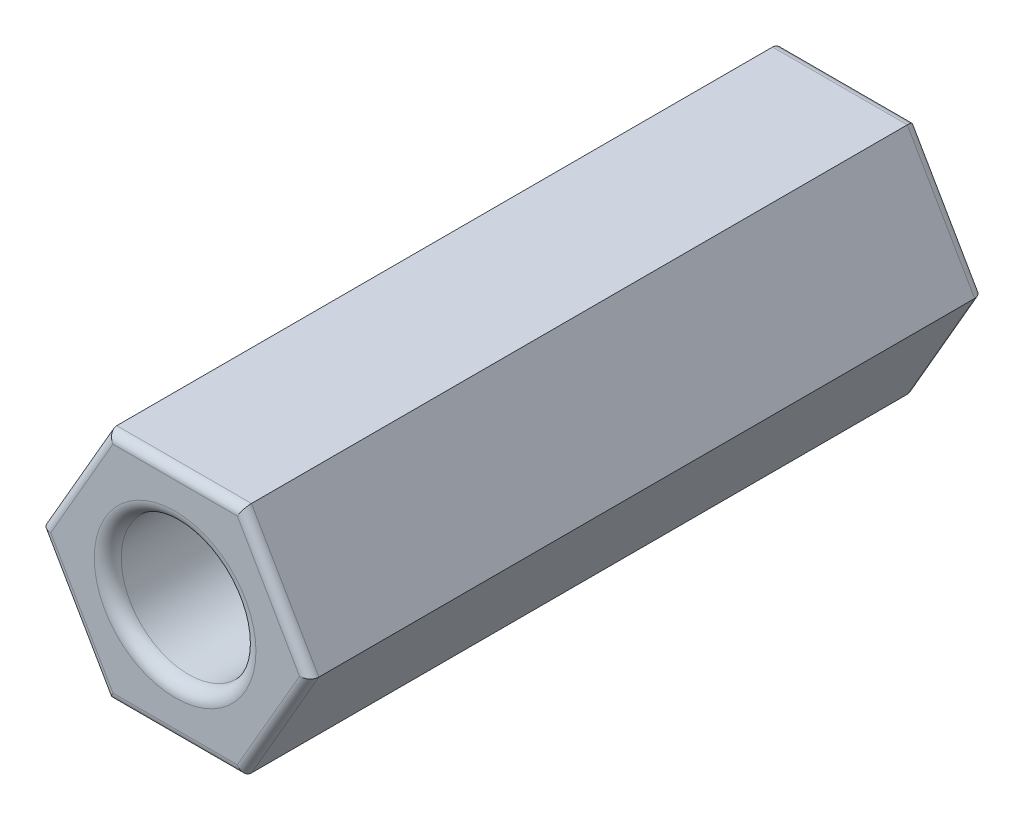
from build123d import *

# Parameters (mm, degrees)
SKETCH1_R           = 1.5
BOSS_EXTRUDE1_DEPTH = 15
FILLET1_R           = 0.3
FILLET2_R           = 0.2


with BuildPart() as part:
    # Sketch1 → Boss-Extrude1 (new body)
    with BuildSketch(Plane.XY):
        Polygon((3, 0), (1.5, 2.598076211), (-1.5, 2.598076211), (-3, 0), (-1.5, -2.598076211), (1.5, -2.598076211), align=None)
        Circle(SKETCH1_R, mode=Mode.SUBTRACT)
    extrude(amount=BOSS_EXTRUDE1_DEPTH)

    # Fillet1
    fillet1_edges = [part.edges().sort_by_distance(p)[0] for p in [
        (-1.5, 0, 0),
        (-1.5, 0, 15),
    ]]
    fillet(fillet1_edges, radius=FILLET1_R)

    # Fillet2
    fillet2_edges = [part.edges().sort_by_distance(p)[0] for p in [
        (-2.25, 1.299038106, 15),
        (-2.25, -1.299038106, 15),
        (0, -2.598076211, 15),
        (2.25, -1.299038106, 15),
        (2.25, 1.299038106, 15),
        (0, 2.598076211, 15),
        (2.25, -1.299038106, 0),
        (0, -2.598076211, 0),
        (-2.25, -1.299038106, 0),
        (-2.25, 1.299038106, 0),
        (0, 2.598076211, 0),
        (2.25, 1.299038106, 0),
    ]]
    fillet(fillet2_edges, radius=FILLET2_R)


solid = part.part
